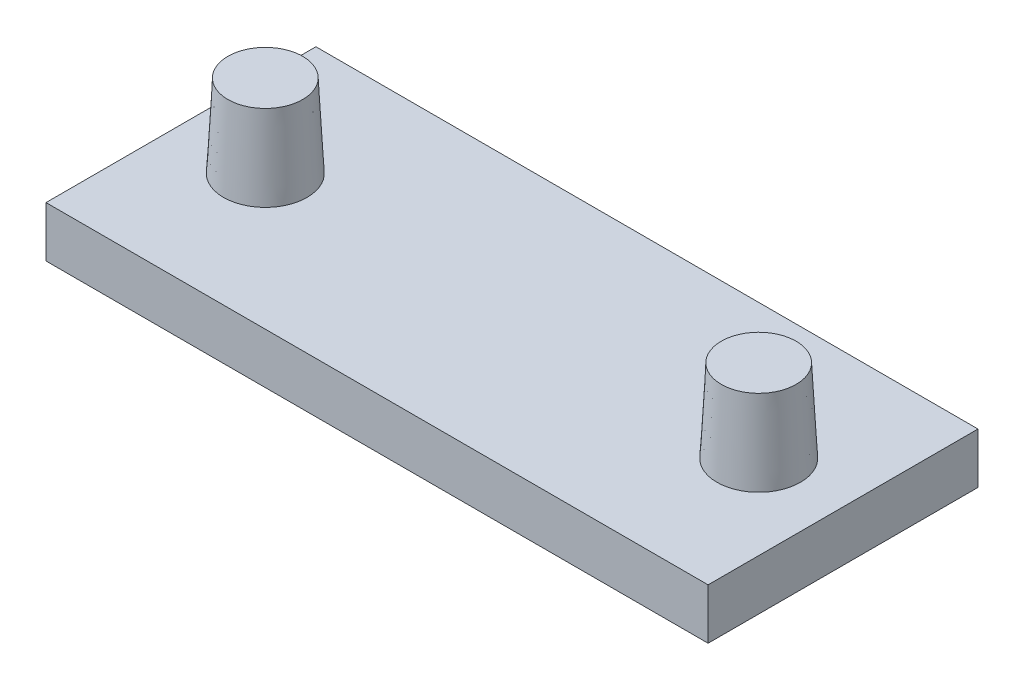
from build123d import *

# Parameters (mm, degrees)
SKETCH1_W                     = 39.25
SKETCH1_H                     = 16
BOSS_EXTRUDE1_DEPTH           = 3
SKETCH2_R                     = 2.475
BOSS_EXTRUDE2_DEPTH           = 4.9
BOSS_EXTRUDE2_DRAFT           = 3
BOSS_EXTRUDE2_PROFILE_2_DEPTH = 4.9
BOSS_EXTRUDE2_PROFILE_2_DRAFT = 3


with BuildPart() as part:
    # Sketch1 → Boss-Extrude1 (new body)
    with BuildSketch(Plane(origin=(0, 0, 0), x_dir=(1, 0, 0), z_dir=(0, 1, 0))):
        with Locations((15.45161309, 5.10225193)):
            Rectangle(SKETCH1_W, SKETCH1_H)
    extrude(amount=BOSS_EXTRUDE1_DEPTH)


with BuildPart() as boss_extrude2_tool:
    # Sketch2 → Boss-Extrude2 (with draft: the straight prism first)
    with BuildSketch(Plane(origin=(0, 3, 0), x_dir=(1, 0, 0), z_dir=(0, 1, 0))):
        with Locations((0.82661309, 5.10225193)):
            Circle(SKETCH2_R)
    extrude(amount=BOSS_EXTRUDE2_DEPTH)
    # Boss-Extrude2: the draft: its side faces are tilted about the plane it starts from
    boss_extrude2_sides = [boss_extrude2_tool.faces().sort_by_distance(p)[0] for p in [
        (-1.64838691, 5.45, -5.10225193),
    ]]
    draft(boss_extrude2_sides, Plane(origin=(0, 3, 0), x_dir=(1, 0, 0), z_dir=(0, 1, 0)), BOSS_EXTRUDE2_DRAFT)


with BuildPart() as part_1:
    add(part.part)

    # Boss-Extrude2: add boss_extrude2_tool
    add(boss_extrude2_tool.part)


with BuildPart() as boss_extrude2_profile_2_tool:
    # Sketch2 → Boss-Extrude2 profile 2 (with draft: the straight prism first)
    with BuildSketch(Plane(origin=(0, 3, 0), x_dir=(1, 0, 0), z_dir=(0, 1, 0))):
        with Locations((30.07661309, 5.10225193)):
            Circle(SKETCH2_R)
    extrude(amount=BOSS_EXTRUDE2_PROFILE_2_DEPTH)
    # Boss-Extrude2 profile 2: the draft: its side faces are tilted about the plane it starts from
    boss_extrude2_profile_2_sides = [boss_extrude2_profile_2_tool.faces().sort_by_distance(p)[0] for p in [
        (27.60161309, 5.45, -5.10225193),
    ]]
    draft(boss_extrude2_profile_2_sides, Plane(origin=(0, 3, 0), x_dir=(1, 0, 0), z_dir=(0, 1, 0)), BOSS_EXTRUDE2_PROFILE_2_DRAFT)


with BuildPart() as part_2:
    add(part_1.part)

    # Boss-Extrude2 profile 2: add boss_extrude2_profile_2_tool
    add(boss_extrude2_profile_2_tool.part)


solid = part_2.part
